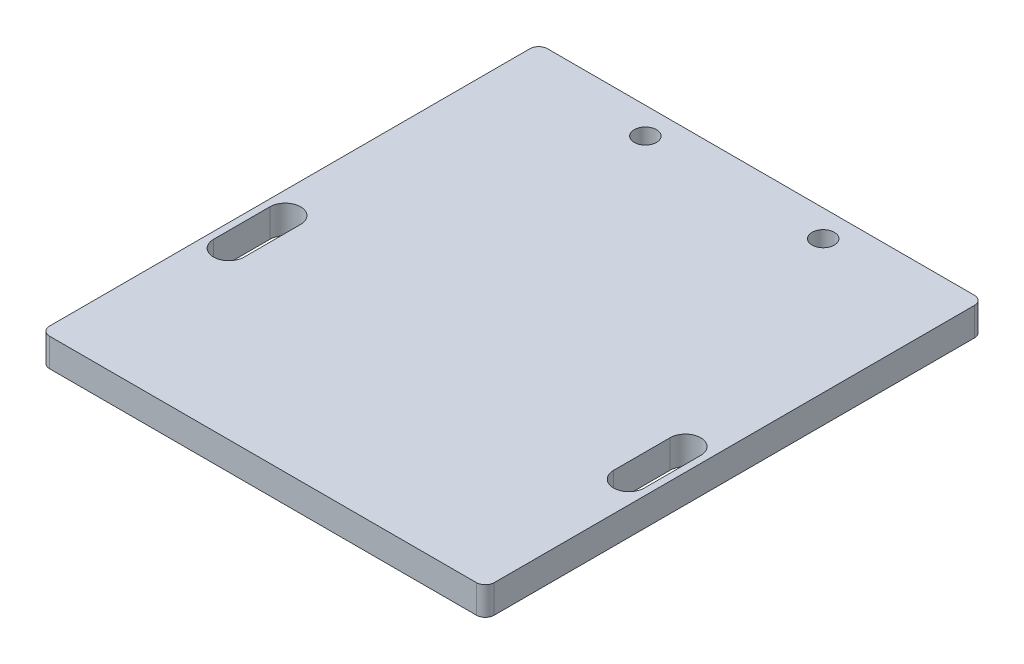
from build123d import *

# Parameters (mm, degrees)
SKETCH1_W               = 50
SKETCH1_H               = 56
SKETCH1_R               = 1.1
BOSS_EXTRUDE1_DEPTH     = 3.175
FILLET1_R               = 1
M3X0_5_TAPPED_HOLE1_D   = 2.5
CUT_EXTRUDE1_DEPTH      = 76.140406074
CUT_EXTRUDE1_DEPTH_BACK = 76.140406074


with BuildPart() as part:
    # Sketch1 → Boss-Extrude1 (new body)
    with BuildSketch(Plane(origin=(0, 0, 0), x_dir=(1, 0, 0), z_dir=(0, 1, 0))):
        with Locations((25, -28)):
            Rectangle(SKETCH1_W, SKETCH1_H)
        with Locations(Location((15, -3, 0), (0, 0, 270))):
            Circle(SKETCH1_R, mode=Mode.SUBTRACT)
        with Locations(Location((35, -3, 0), (0, 0, 270))):
            Circle(SKETCH1_R, mode=Mode.SUBTRACT)
    extrude(amount=BOSS_EXTRUDE1_DEPTH)

    # Fillet1
    fillet1_edges = [part.edges().sort_by_distance(p)[0] for p in [
        (0, 1.5875, 0),
        (50, 1.5875, 0),
        (50, 1.5875, 56),
        (0, 1.5875, 56),
    ]]
    fillet(fillet1_edges, radius=FILLET1_R)

    # M3x0.5 Tapped Hole1 (through all)
    with Locations(Plane(origin=(15, 3.175, 3), x_dir=(0, 0, 1), z_dir=(0, 1, 0))):
        with Locations((0, 0), (0, 20)):
            Hole(M3X0_5_TAPPED_HOLE1_D / 2)

    # Sketch3 → Cut-Extrude1 (cut, two sides: drawn at the far end of the back side and taken through both)
    with BuildSketch(Plane(origin=(0, 3.175, 0), x_dir=(1, 0, 0), z_dir=(0, 1, 0)).offset(-CUT_EXTRUDE1_DEPTH_BACK)):
        with BuildLine():
            Line((0.775, -31), (0.775, -37.35))
            ThreePointArc((0.775, -37.35), (2.5, -39.075), (4.225, -37.35))
            Line((4.225, -37.35), (4.225, -31))
            ThreePointArc((4.225, -31), (2.5, -29.275), (0.775, -31))
        make_face()
        with BuildLine():
            Line((45.775, -31), (45.775, -37.35))
            ThreePointArc((45.775, -37.35), (47.5, -39.075), (49.225, -37.35))
            Line((49.225, -37.35), (49.225, -31))
            ThreePointArc((49.225, -31), (47.5, -29.275), (45.775, -31))
        make_face()
    extrude(amount=CUT_EXTRUDE1_DEPTH + CUT_EXTRUDE1_DEPTH_BACK, mode=Mode.SUBTRACT)


solid = part.part
